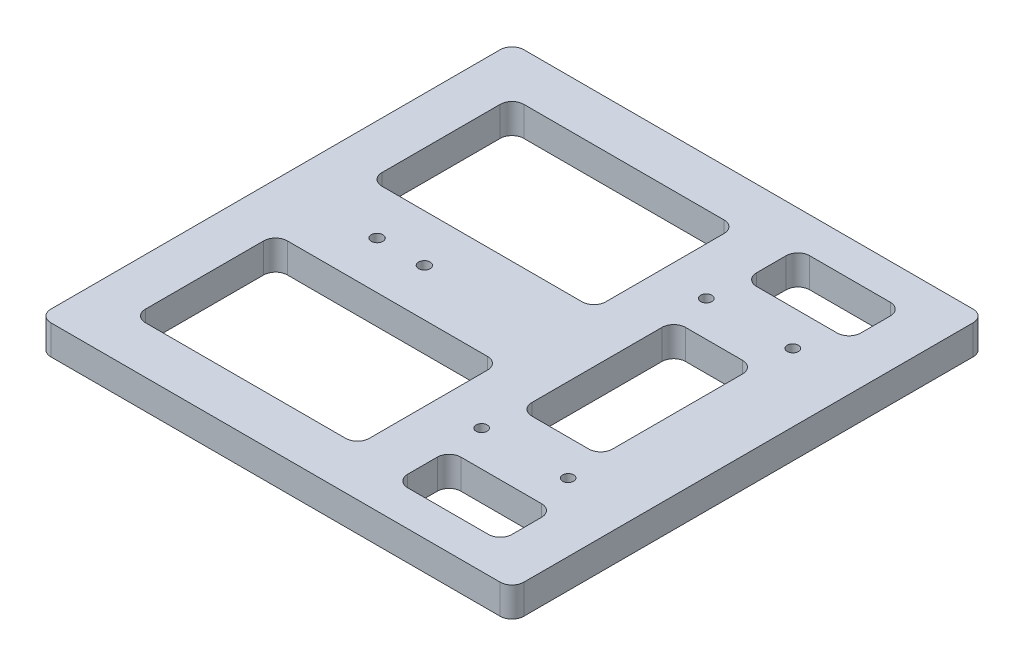
from build123d import *

# Parameters (mm, degrees)
BASE_W              = 101.6
BASE_H              = 101.6
BOSS_EXTRUDE2_DEPTH = 6.35
SKETCH1_R           = 1.1938
SKETCH1_R_2         = 1.2446
CUT_EXTRUDE1_DEPTH  = 73.122135992
FILLET1_R           = 2.54
SKETCH2_R           = 2.794
CUT_EXTRUDE2_DEPTH  = 2.032
CUT_EXTRUDE3_DEPTH  = 73.122135992


with BuildPart() as part:
    # Base → Boss-Extrude2 (new body)
    with BuildSketch(Plane(origin=(0, 0, 0), x_dir=(1, 0, 0), z_dir=(0, 1, 0))):
        Rectangle(BASE_W, BASE_H)
    extrude(amount=BOSS_EXTRUDE2_DEPTH)

    # Sketch1 → Cut-Extrude1 (cut, through all)
    with BuildSketch(Plane(origin=(0, 6.35, 0), x_dir=(1, 0, 0), z_dir=(0, 1, 0))):
        with Locations(Location((17.6022, 24.13, 0), (0, 0, 270))):
            Circle(SKETCH1_R)
        with Locations(Location((36.195, 24.13, 0), (0, 0, 90))):
            Circle(SKETCH1_R)
        with Locations(Location((17.6022, -24.13, 0), (0, 0, 90))):
            Circle(SKETCH1_R)
        with Locations(Location((36.195, -24.13, 0), (0, 0, 270))):
            Circle(SKETCH1_R)
        with Locations(Location((-28.9814, 0, 0), (0, 0, 270))):
            Circle(SKETCH1_R_2)
        with Locations(Location((-18.8214, 0, 0), (0, 0, 270))):
            Circle(SKETCH1_R_2)
    extrude(amount=-CUT_EXTRUDE1_DEPTH, mode=Mode.SUBTRACT)

    # Fillet1
    fillet1_edges = [part.edges().sort_by_distance(p)[0] for p in [
        (50.8, 3.175, 50.8),
        (-50.8, 3.175, 50.8),
        (-50.8, 3.175, -50.8),
        (50.8, 3.175, -50.8),
    ]]
    fillet(fillet1_edges, radius=FILLET1_R)

    # Sketch2 → Cut-Extrude2 (cut)
    with BuildSketch(Plane.XZ):
        with Locations(Location((17.6022, 24.13, 0), (0, 0, 270))):
            Circle(SKETCH2_R)
        with Locations(Location((36.195, 24.13, 0), (0, 0, 270))):
            Circle(SKETCH2_R)
        with Locations(Location((36.195, -24.13, 0), (0, 0, 270))):
            Circle(SKETCH2_R)
        with Locations(Location((17.6022, -24.13, 0), (0, 0, 270))):
            Circle(SKETCH2_R)
        with Locations(Location((-18.8214, 0, 0), (0, 0, 270))):
            Circle(SKETCH2_R)
        with Locations(Location((-28.9814, 0, 0), (0, 0, 270))):
            Circle(SKETCH2_R)
    extrude(amount=-CUT_EXTRUDE2_DEPTH, mode=Mode.SUBTRACT)

    # Sketch3 → Cut-Extrude3 (cut, through all)
    with BuildSketch(Plane(origin=(0, 6.35, 0), x_dir=(1, 0, 0), z_dir=(0, 1, 0))):
        with BuildLine():
            Line((-38.1, -10.16), (4.9022, -10.16))
            ThreePointArc((4.9022, -10.16), (6.698251224, -10.903948776), (7.4422, -12.7))
            Line((7.4422, -12.7), (7.4422, -38.1))
            ThreePointArc((7.4422, -38.1), (6.698251224, -39.896051224), (4.9022, -40.64))
            Line((4.9022, -40.64), (-38.1, -40.64))
            ThreePointArc((-38.1, -40.64), (-39.896051224, -39.896051224), (-40.64, -38.1))
            Line((-40.64, -38.1), (-40.64, -12.7))
            ThreePointArc((-40.64, -12.7), (-39.896051224, -10.903948776), (-38.1, -10.16))
        make_face()
        with BuildLine():
            Line((-38.1, 40.64), (4.9022, 40.64))
            ThreePointArc((4.9022, 40.64), (6.698251224, 39.896051224), (7.4422, 38.1))
            Line((7.4422, 38.1), (7.4422, 12.7))
            ThreePointArc((7.4422, 12.7), (6.698251224, 10.903948776), (4.9022, 10.16))
            Line((4.9022, 10.16), (-38.1, 10.16))
            ThreePointArc((-38.1, 10.16), (-39.896051224, 10.903948776), (-40.64, 12.7))
            Line((-40.64, 12.7), (-40.64, 38.1))
            ThreePointArc((-40.64, 38.1), (-39.896051224, 39.896051224), (-38.1, 40.64))
        make_face()
        with BuildLine():
            Line((20.7772, 16.51), (33.02, 16.51))
            ThreePointArc((33.02, 16.51), (34.816051224, 15.766051224), (35.56, 13.97))
            Line((35.56, 13.97), (35.56, -13.97))
            ThreePointArc((35.56, -13.97), (34.816051224, -15.766051224), (33.02, -16.51))
            Line((33.02, -16.51), (20.7772, -16.51))
            ThreePointArc((20.7772, -16.51), (18.981148776, -15.766051224), (18.2372, -13.97))
            Line((18.2372, -13.97), (18.2372, 13.97))
            ThreePointArc((18.2372, 13.97), (18.981148776, 15.766051224), (20.7772, 16.51))
        make_face()
        with BuildLine():
            Line((20.7772, 43.18), (38.1, 43.18))
            ThreePointArc((38.1, 43.18), (39.896051224, 42.436051224), (40.64, 40.64))
            Line((40.64, 40.64), (40.64, 34.29))
            ThreePointArc((40.64, 34.29), (39.896051224, 32.493948776), (38.1, 31.75))
            Line((38.1, 31.75), (20.7772, 31.75))
            ThreePointArc((20.7772, 31.75), (18.981148776, 32.493948776), (18.2372, 34.29))
            Line((18.2372, 34.29), (18.2372, 40.64))
            ThreePointArc((18.2372, 40.64), (18.981148776, 42.436051224), (20.7772, 43.18))
        make_face()
        with BuildLine():
            Line((20.7772, -31.75), (38.1, -31.75))
            ThreePointArc((38.1, -31.75), (39.896051224, -32.493948776), (40.64, -34.29))
            Line((40.64, -34.29), (40.64, -40.64))
            ThreePointArc((40.64, -40.64), (39.896051224, -42.436051224), (38.1, -43.18))
            Line((38.1, -43.18), (20.7772, -43.18))
            ThreePointArc((20.7772, -43.18), (18.981148776, -42.436051224), (18.2372, -40.64))
            Line((18.2372, -40.64), (18.2372, -34.29))
            ThreePointArc((18.2372, -34.29), (18.981148776, -32.493948776), (20.7772, -31.75))
        make_face()
    extrude(amount=-CUT_EXTRUDE3_DEPTH, mode=Mode.SUBTRACT)


solid = part.part
